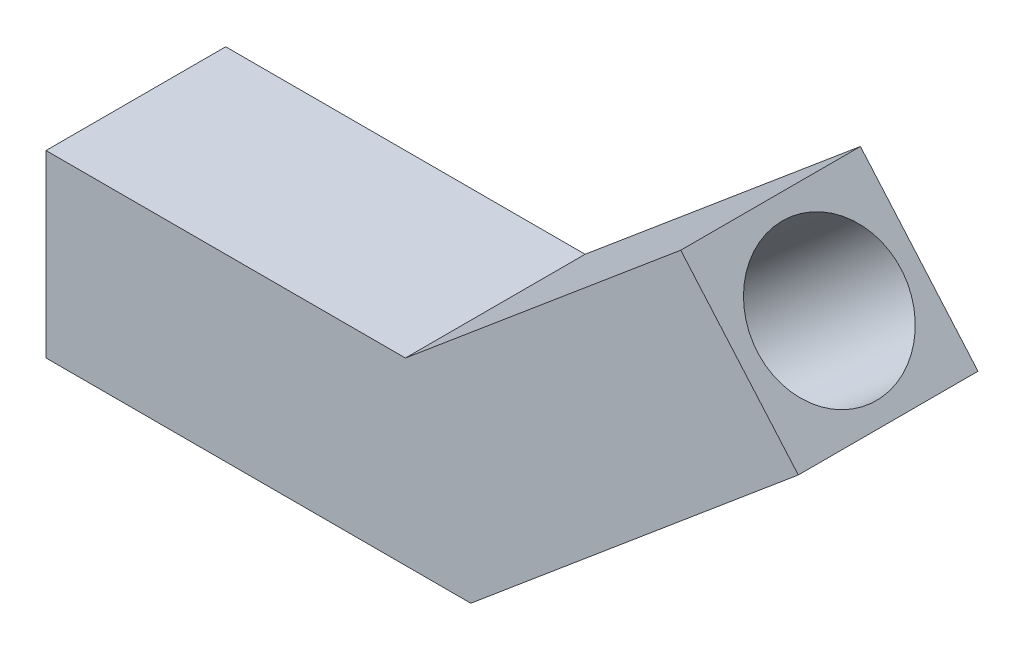
from build123d import *

# Parameters (mm, degrees)
BOSS_EXTRUDE1_DEPTH = 2.5
SKETCH2_R           = 1
CUT_EXTRUDE1_DEPTH  = 5
SKETCH3_R           = 1
CUT_EXTRUDE2_DEPTH  = 5


with BuildPart() as part:
    # Sketch1 → Boss-Extrude1 (new body)
    with BuildSketch(Plane.XY):
        Polygon((-5, 0), (0, 0), (3.830222216, 3.213938048), (5.465982834, 1.323359513), (0.909480399, -2.5), (-5, -2.5), align=None)
    extrude(amount=BOSS_EXTRUDE1_DEPTH)

    # Sketch2 → Cut-Extrude1 (cut)
    with BuildSketch(Plane(origin=(3.780724263, 3.271146765, 0), x_dir=(0, 0, -1), z_dir=(0.7562314141303861, 0.6543042474891606, 0))):
        with Locations(Location((-1.25, -1.325649749, 0), (0, 0, 90))):
            Circle(SKETCH2_R)
    extrude(amount=-CUT_EXTRUDE1_DEPTH, mode=Mode.SUBTRACT)

    # Sketch3 → Cut-Extrude2 (cut)
    with BuildSketch(Plane.ZY.offset(5)):
        with Locations((1.25, -1.25)):
            Circle(SKETCH3_R)
    extrude(amount=-CUT_EXTRUDE2_DEPTH, mode=Mode.SUBTRACT)


solid = part.part
